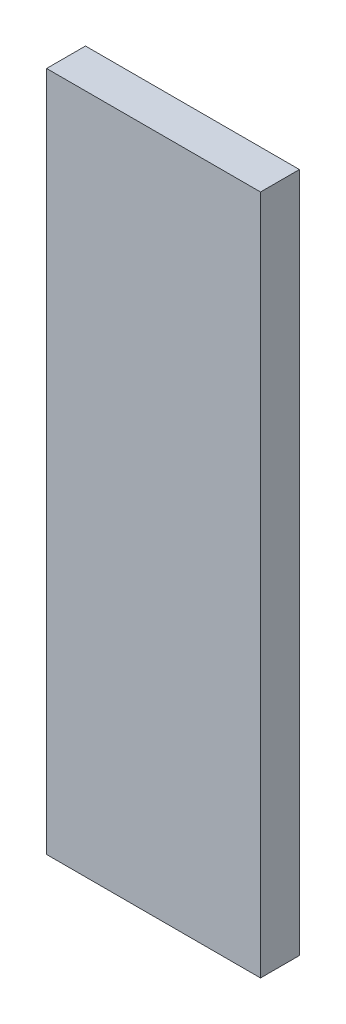
from build123d import *

# Parameters (mm, degrees)
SKETCH1_W           = 55.88
SKETCH1_H           = 177.8
BOSS_EXTRUDE1_DEPTH = 5.08


with BuildPart() as part:
    # Sketch1 → Boss-Extrude1 (new, symmetric)
    with BuildSketch(Plane.XY):
        Rectangle(SKETCH1_W, SKETCH1_H)
    extrude(amount=BOSS_EXTRUDE1_DEPTH, both=True)


solid = part.part
